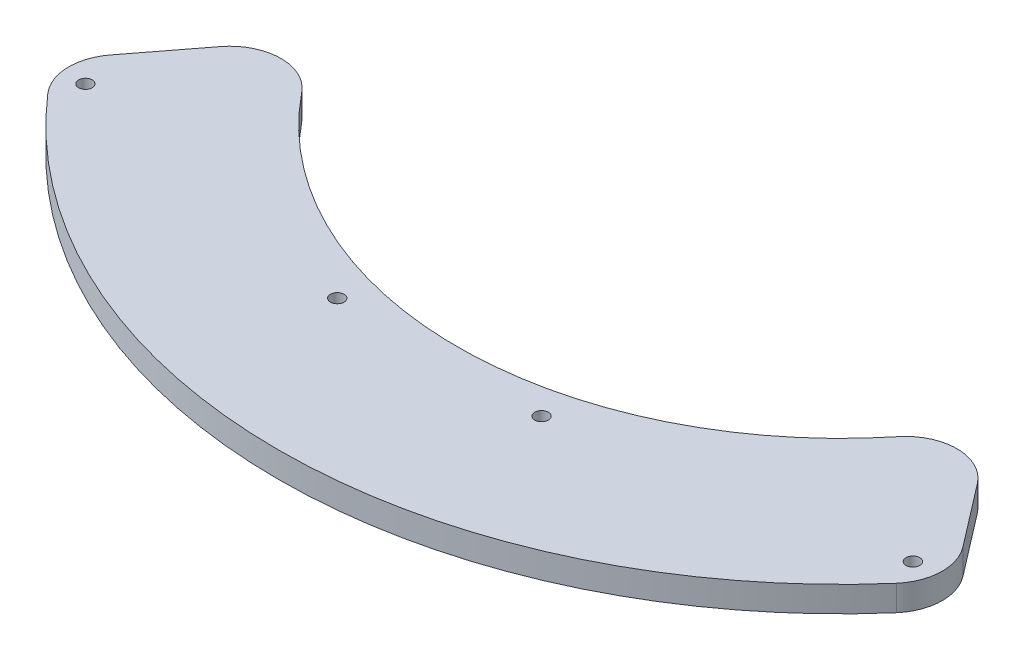
from build123d import *

# Parameters (mm, degrees)
SKETCH1_R           = 1.70053
BOSS_EXTRUDE1_DEPTH = 6.35


with BuildPart() as part:
    # Sketch1 → Boss-Extrude1 (new body)
    with BuildSketch(Plane(origin=(0, 0, 0), x_dir=(1, 0, 0), z_dir=(0, 1, 0))):
        with BuildLine():
            Line((-105.977429974, 26.723858277), (-94.097535909, 42.20603765))
            ThreePointArc((-94.097535909, 42.20603765), (-84.176111379, 47.17383179), (-74.137013371, 42.448352501))
            ThreePointArc((-74.137013371, 42.448352501), (0, 7.00024), (74.137013371, 42.448352501))
            ThreePointArc((74.137013371, 42.448352501), (84.176111379, 47.17383179), (94.097535909, 42.20603765))
            Line((94.097535909, 42.20603765), (105.977429974, 26.723858277))
            ThreePointArc((105.977429974, 26.723858277), (108.596043585, 18.608843232), (105.492026807, 10.666822942))
            ThreePointArc((105.492026807, 10.666822942), (0, -37.44976), (-105.492026807, 10.666822942))
            ThreePointArc((-105.492026807, 10.666822942), (-108.596043585, 18.608843232), (-105.977429974, 26.723858277))
        make_face()
        with Locations(Location((102.87, 17.39751111, 0), (0, 0, 270))):
            Circle(SKETCH1_R, mode=Mode.SUBTRACT)
        with Locations(Location((25.4, 2.54, 0), (0, 0, 270))):
            Circle(SKETCH1_R, mode=Mode.SUBTRACT)
        with Locations(Location((-102.87, 17.39751111, 0), (0, 0, 90))):
            Circle(SKETCH1_R, mode=Mode.SUBTRACT)
        with Locations(Location((-25.4, 2.54, 0), (0, 0, 90))):
            Circle(SKETCH1_R, mode=Mode.SUBTRACT)
    extrude(amount=BOSS_EXTRUDE1_DEPTH)


solid = part.part
